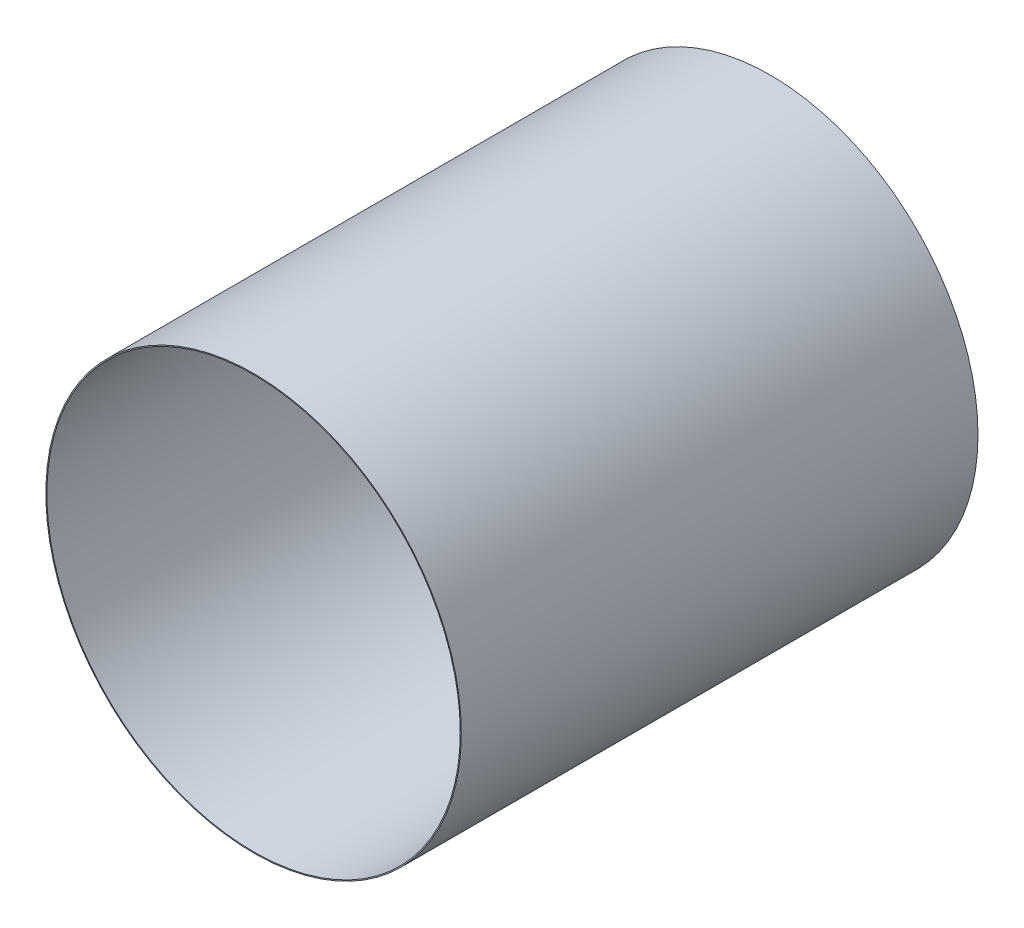
from build123d import *

# Parameters (mm, degrees)
SKETCH1_R           = 10.05
SKETCH1_R_2         = 10
BOSS_EXTRUDE1_DEPTH = 25


with BuildPart() as part:
    # Sketch1 → Boss-Extrude1 (new body)
    with BuildSketch(Plane.XY):
        Circle(SKETCH1_R)
        Circle(SKETCH1_R_2, mode=Mode.SUBTRACT)
    extrude(amount=BOSS_EXTRUDE1_DEPTH)


solid = part.part
